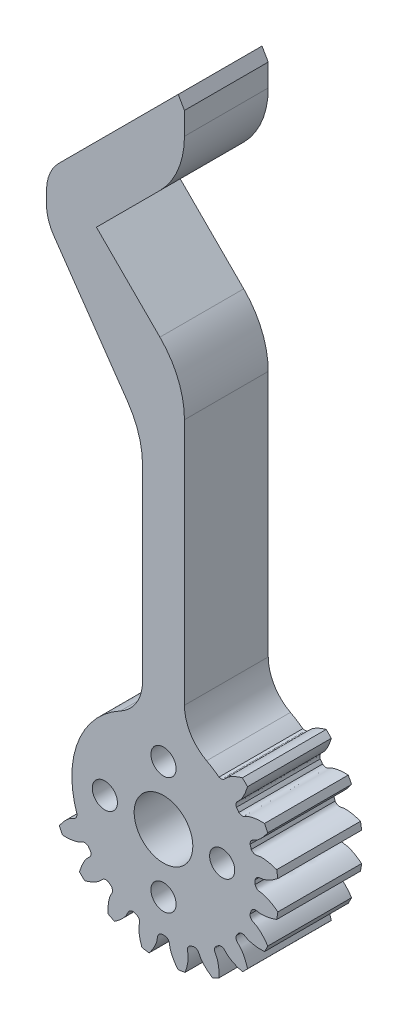
from build123d import *

# Parameters (mm, degrees)
SKETCH_1_R               = 13.75
EXTRUDE_1_DEPTH          = 10
CUT_EXTRUDE_1_DEPTH      = 22.866069606
PATTERN_CIRCULAR_1_COUNT = 20
EXTRUDE_2_DEPTH          = 10
SKETCH_4_R               = 3.5
SKETCH_4_R_2             = 1.5
CUT_EXTRUDE_2_DEPTH      = 20
CUT_EXTRUDE_START        = -10
CUT_EXTRUDE_5_DEPTH      = 10
CUT_EXTRUDE_7_DEPTH      = 10
FILLET_7_R               = 5
FILLET_8_R               = 10
FILLET_15_R              = 5
FILLET_16_R              = 10


with BuildPart() as part:
    # 草图1 → 凸台-拉伸1 (new body)
    with BuildSketch(Plane.XY):
        Circle(SKETCH_1_R)
    extrude(amount=EXTRUDE_1_DEPTH)

    # 草图2 → 切除-拉伸1 (cut, through all)
    with BuildSketch(Plane.XY):
        with BuildLine():
            ThreePointArc((0.241645751, 10.934830295), (0, 10.9375), (-0.241645751, 10.934830295))
            add(Edge.make_bspline(
                [(-0.241645751, 10.934830295), (-0.763986756, 11.11684439), (-0.696355124, 11.483892124), (-0.766121321, 11.837511753), (-0.773615233, 11.871945767), (-0.782888612, 11.910793269), (-0.794115121, 11.953996045), (-0.807473925, 12.001489371), (-0.823140069, 12.053203535), (-0.841287339, 12.109063416), (-0.862087187, 12.168988684), (-0.885708875, 12.232893806), (-0.912319248, 12.300688126), (-0.942082628, 12.372275913), (-0.975160664, 12.447556439), (-1.011712206, 12.526424039), (-1.051893167, 12.608768189), (-1.095856396, 12.694473577), (-1.143751548, 12.783420187), (-1.195724957, 12.87548338), (-1.251919512, 12.970533976), (-1.312474533, 13.068438347), (-1.377525652, 13.169058507), (-1.447204695, 13.272252205), (-1.521639564, 13.377873025), (-1.600954126, 13.485770488), (-1.685268101, 13.595790151), (-1.774696952, 13.707773716), (-1.869351783, 13.821559139), (-1.969339231, 13.936980743), (-2.074761371, 14.053869328), (-2.185715611, 14.172052294), (-2.302294605, 14.291353753), (-2.424586158, 14.411594659), (-2.552673133, 14.532592924), (-2.686633373, 14.654163553), (-2.826539612, 14.776118764), (-2.972459398, 14.898268124), (-3.124455015, 15.020418683), (-3.282583418, 15.142375102), (-3.446896124, 15.2639398), (-3.676841988, 15.427049835), (-3.854915516, 15.545415751), (-3.976447477, 15.622814825)],
                knots=[0, 0, 0, 0, 0.165916003, 0.170905922, 0.176663519, 0.183188797, 0.190481754, 0.198542391, 0.207370708, 0.216966704, 0.22733038, 0.238461736, 0.250360771, 0.263027487, 0.276461881, 0.290663956, 0.30563371, 0.321371144, 0.337876258, 0.355149051, 0.373189524, 0.391997677, 0.411573509, 0.431917021, 0.453028213, 0.474907084, 0.497553636, 0.520967867, 0.545149777, 0.570099367, 0.595816637, 0.622301587, 0.649554216, 0.677574526, 0.706362514, 0.735918183, 0.766241531, 0.797332559, 0.829191267, 0.861817654, 0.895211721, 0.929373468, 1, 1, 1, 1], degree=3))
            ThreePointArc((-3.976447477, 15.622814825), (0, 16.120932901), (3.976447477, 15.622814825))
            add(Edge.make_bspline(
                [(0.241645751, 10.934830295), (0.763986756, 11.11684439), (0.696355124, 11.483892124), (0.766121321, 11.837511753), (0.773615233, 11.871945767), (0.782888612, 11.910793269), (0.794115121, 11.953996045), (0.807473925, 12.001489371), (0.823140069, 12.053203535), (0.841287339, 12.109063416), (0.862087187, 12.168988684), (0.885708875, 12.232893806), (0.912319248, 12.300688126), (0.942082628, 12.372275913), (0.975160664, 12.447556439), (1.011712206, 12.526424039), (1.051893167, 12.608768189), (1.095856396, 12.694473577), (1.143751548, 12.783420187), (1.195724957, 12.87548338), (1.251919512, 12.970533976), (1.312474533, 13.068438347), (1.377525652, 13.169058507), (1.447204695, 13.272252205), (1.521639564, 13.377873025), (1.600954126, 13.485770488), (1.685268101, 13.595790151), (1.774696952, 13.707773716), (1.869351783, 13.821559139), (1.969339231, 13.936980743), (2.074761371, 14.053869328), (2.185715611, 14.172052294), (2.302294605, 14.291353753), (2.424586158, 14.411594659), (2.552673133, 14.532592924), (2.686633373, 14.654163553), (2.826539612, 14.776118764), (2.972459398, 14.898268124), (3.124455015, 15.020418683), (3.282583418, 15.142375102), (3.446896124, 15.2639398), (3.676841988, 15.427049835), (3.854915516, 15.545415751), (3.976447477, 15.622814825)],
                knots=[0, 0, 0, 0, 0.165916003, 0.170905922, 0.176663519, 0.183188797, 0.190481754, 0.198542391, 0.207370708, 0.216966704, 0.22733038, 0.238461736, 0.250360771, 0.263027487, 0.276461881, 0.290663956, 0.30563371, 0.321371144, 0.337876258, 0.355149051, 0.373189524, 0.391997677, 0.411573509, 0.431917021, 0.453028213, 0.474907084, 0.497553636, 0.520967867, 0.545149777, 0.570099367, 0.595816637, 0.622301587, 0.649554216, 0.677574526, 0.706362514, 0.735918183, 0.766241531, 0.797332559, 0.829191267, 0.861817654, 0.895211721, 0.929373468, 1, 1, 1, 1], degree=3))
        make_face()
    cut_extrude_1 = extrude(amount=CUT_EXTRUDE_1_DEPTH, mode=Mode.SUBTRACT)

    # 阵列(圆周)1: 切除-拉伸1 ×20 about axis
    pattern_circular_1_axis = Axis((0, 0, -1.5), (0, 0, 1))
    for i in range(1, PATTERN_CIRCULAR_1_COUNT):
        add(cut_extrude_1.rotate(pattern_circular_1_axis, i * 360 / PATTERN_CIRCULAR_1_COUNT), mode=Mode.SUBTRACT)

    # 草图6 → 凸台-拉伸2 (add)
    with BuildSketch(Plane(origin=(0, 0, 0), x_dir=(-1, 0, 0), z_dir=(0, 0, -1))):
        with BuildLine():
            Line((-2.5, 0), (2.5, 0))
            Line((2.5, 0), (2.5, 10.557184455))
            add(Edge.make_bspline(
                [(2.5, 10.557184455), (4.142038477, 10.001161271), (4.136822373, 10.5737216), (4.393103935, 11.03302397), (4.418885843, 11.076011904), (4.458931571, 11.138710403), (4.509766902, 11.213065778), (4.58267603, 11.311112911), (4.671237054, 11.420807284), (4.776478734, 11.5410308), (4.899365137, 11.670602183), (5.040791529, 11.808280759), (5.201581362, 11.952770029), (5.38248323, 12.10272148), (5.584168076, 12.256738531), (5.744241751, 12.369149234), (5.836552423, 12.430773747), (5.853360338, 12.441891848)],
                knots=[0.417961645, 0.417961645, 0.417961645, 0.417961645, 0.658484305, 0.663474224, 0.675757099, 0.683050056, 0.69993901, 0.719898682, 0.742929074, 0.769030183, 0.798202012, 0.83044456, 0.865757826, 0.904141811, 0.945596515, 0.990121938, 1, 1, 1, 1], degree=3))
            Line((5.853360338, 12.441891848), (2.5, 14.377955342))
            Line((2.5, 14.377955342), (2.5, 39.485006005))
            Line((2.5, 39.485006005), (13.87748833, 55.93349406))
            ThreePointArc((13.87748833, 55.93349406), (13.973609229, 58.604726359), (13.799906223, 61.272037457))
            Line((13.799906223, 61.272037457), (-1.756442963, 76.828386643))
            Line((-1.756442963, 76.828386643), (-2.5, 75.540508076))
            Line((-2.5, 75.540508076), (-2.5, 68.726096654))
            Line((-2.5, 68.726096654), (8.006096654, 58.22))
            Line((8.006096654, 58.22), (-2.5, 47.713903346))
            Line((-2.5, 47.713903346), (-2.5, 14.377955342))
            Line((-2.5, 14.377955342), (-5.853360338, 12.441891848))
            add(Edge.make_bspline(
                [(-2.5, 10.557184455), (-4.142038477, 10.001161271), (-4.136822373, 10.5737216), (-4.393103935, 11.03302397), (-4.418885843, 11.076011904), (-4.458931571, 11.138710403), (-4.509766902, 11.213065778), (-4.58267603, 11.311112911), (-4.671237054, 11.420807284), (-4.776478734, 11.5410308), (-4.899365137, 11.670602183), (-5.040791529, 11.808280759), (-5.201581362, 11.952770029), (-5.38248323, 12.10272148), (-5.584168076, 12.256738531), (-5.744241751, 12.369149234), (-5.836552423, 12.430773747), (-5.853360338, 12.441891848)],
                knots=[-0.074606657, -0.074606657, -0.074606657, -0.074606657, 0.165916003, 0.170905922, 0.183188797, 0.190481754, 0.207370708, 0.22733038, 0.250360771, 0.276461881, 0.30563371, 0.337876258, 0.373189524, 0.411573509, 0.453028213, 0.497553636, 0.507431698, 0.507431698, 0.507431698, 0.507431698], degree=3))
            Line((-2.5, 10.557184455), (-2.5, 0))
        make_face()
    extrude(amount=-EXTRUDE_2_DEPTH)

    # 草图4 → 切除-拉伸2 (cut)
    with BuildSketch(Plane.XY.offset(10)):
        Circle(SKETCH_4_R)
        with Locations((0, 7)):
            Circle(SKETCH_4_R_2)
        with Locations((7, 0)):
            Circle(SKETCH_4_R_2)
        with Locations((0, -7)):
            Circle(SKETCH_4_R_2)
        with Locations((-7, 0)):
            Circle(SKETCH_4_R_2)
    extrude(amount=-CUT_EXTRUDE_2_DEPTH, mode=Mode.SUBTRACT)

    # 草图17 → 切除-拉伸5 (cut)
    with BuildSketch(Plane.XY.offset(10).offset(CUT_EXTRUDE_START)):
        with BuildLine():
            ThreePointArc((-10.324968963, -3.608867158), (-10.47431425, 3.149229626), (-6.622827503, 8.704427731))
            Line((-6.622827503, 8.704427731), (-10.596524004, 13.927084369))
            ThreePointArc((-10.596524004, 13.927084369), (-16.7589028, 5.038767402), (-16.519950341, -5.774187452))
            Line((-16.519950341, -5.774187452), (-10.324968963, -3.608867158))
        make_face()
    extrude(amount=CUT_EXTRUDE_5_DEPTH, mode=Mode.SUBTRACT)

    # 草图20 → 切除-拉伸7 (cut)
    with BuildSketch(Plane(origin=(0, 0, 0), x_dir=(-1, 0, 0), z_dir=(0, 0, -1))):
        with BuildLine():
            Line((-2.5, 10.647953148), (-2.5, 14.377955342))
            Line((-2.5, 14.377955342), (-5.853360338, 12.441891848))
            ThreePointArc((-5.853360338, 12.441891848), (-6.242369371, 12.251339708), (-6.625183064, 12.048628526))
            add(Edge.make_bspline(
                [(-6.231836465, 8.988499348), (-5.916238915, 9.442776183), (-6.1866993, 9.699971162), (-6.343702187, 10.03914452), (-6.36332593, 10.085270195), (-6.390511793, 10.154521122), (-6.420786297, 10.239352761), (-6.457253184, 10.355968144), (-6.493942932, 10.492092252), (-6.529346293, 10.647900169), (-6.561940927, 10.823477506), (-6.590196887, 11.018819297), (-6.61258127, 11.233829666), (-6.627563092, 11.468321604), (-6.633618126, 11.722017023), (-6.630471349, 11.9175927), (-6.626067777, 12.028495582), (-6.625183064, 12.048628526)],
                knots=[0.492568302, 0.492568302, 0.492568302, 0.492568302, 0.658484305, 0.663474224, 0.675757099, 0.683050056, 0.69993901, 0.719898682, 0.742929074, 0.769030183, 0.798202012, 0.83044456, 0.865757826, 0.904141811, 0.945596515, 0.990121938, 1, 1, 1, 1], degree=3))
            ThreePointArc((-6.231836465, 8.988499348), (-4.444062189, 9.993959051), (-2.5, 10.647953148))
        make_face()
        with BuildLine():
            Line((2.5, 14.377955342), (2.5, 10.647953148))
            ThreePointArc((2.5, 10.647953148), (4.444062189, 9.993959051), (6.231836465, 8.988499348))
            add(Edge.make_bspline(
                [(6.231836465, 8.988499348), (5.916238915, 9.442776183), (6.1866993, 9.699971162), (6.343702187, 10.03914452), (6.36332593, 10.085270195), (6.390511793, 10.154521122), (6.420786297, 10.239352761), (6.457253184, 10.355968144), (6.493942932, 10.492092252), (6.529346293, 10.647900169), (6.561940927, 10.823477506), (6.590196887, 11.018819297), (6.61258127, 11.233829666), (6.627563092, 11.468321604), (6.633618126, 11.722017023), (6.630471349, 11.9175927), (6.626067777, 12.028495582), (6.625183064, 12.048628526)],
                knots=[0, 0, 0, 0, 0.165916003, 0.170905922, 0.183188797, 0.190481754, 0.207370708, 0.22733038, 0.250360771, 0.276461881, 0.30563371, 0.337876258, 0.373189524, 0.411573509, 0.453028213, 0.497553636, 0.507431698, 0.507431698, 0.507431698, 0.507431698], degree=3))
            ThreePointArc((6.625183064, 12.048628526), (6.242369371, 12.251339708), (5.853360338, 12.441891848))
            Line((5.853360338, 12.441891848), (2.5, 14.377955342))
        make_face()
    extrude(amount=-CUT_EXTRUDE_7_DEPTH, mode=Mode.SUBTRACT)

    # 圆角7
    fillet_7_edges = [part.edges().sort_by_distance(p)[0] for p in [
        (-2.5, 10.647953148, 5),
        (2.5, 10.647953148, 5),
    ]]
    fillet(fillet_7_edges, radius=FILLET_7_R)

    # 圆角8
    fillet_8_edges = [part.edges().sort_by_distance(p)[0] for p in [
        (2.5, 47.713903346, 5),
        (2.5, 68.726096654, 5),
    ]]
    fillet(fillet_8_edges, radius=FILLET_8_R)

    # 圆角15
    fillet_15_edges = [part.edges().sort_by_distance(p)[0] for p in [
        (-13.799906223, 61.272037457, 5),
        (-13.87748833, 55.93349406, 5),
    ]]
    fillet(fillet_15_edges, radius=FILLET_15_R)

    # 圆角16
    fillet_16_edges = [part.edges().sort_by_distance(p)[0] for p in [
        (-2.5, 39.485006005, 5),
    ]]
    fillet(fillet_16_edges, radius=FILLET_16_R)


solid = part.part
